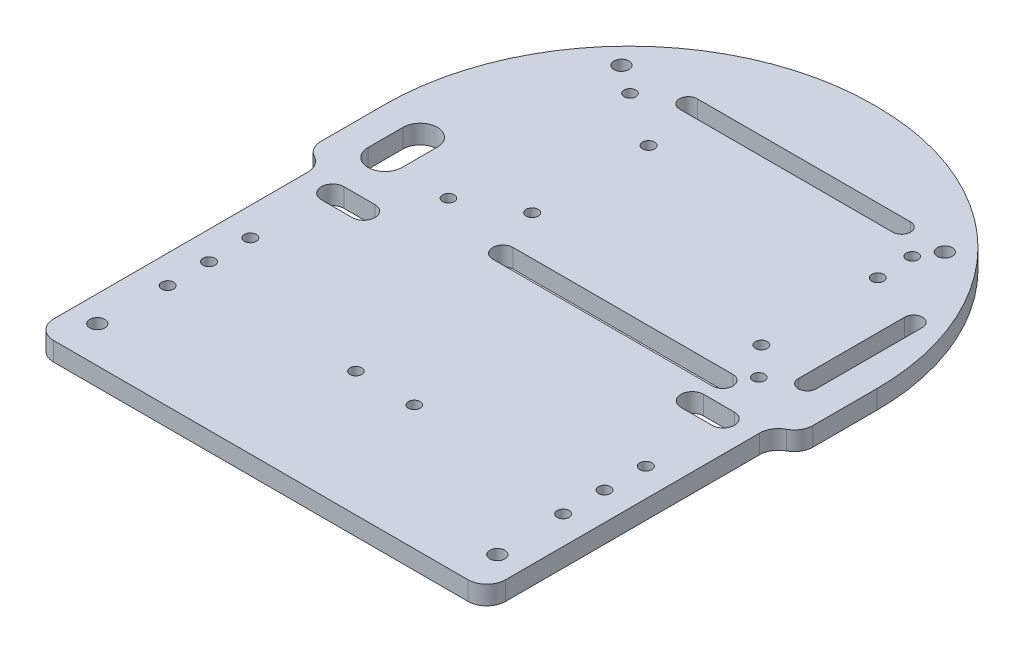
from build123d import *

# Parameters (mm, degrees)
BOSS_EXTRUDE2_DEPTH = 5
FILLET8_R           = 65
SKETCH4_R           = 2
SKETCH4_R_2         = 1.5621
SKETCH4_R_3         = 1.55575
SKETCH4_R_4         = 1.6
CUT_EXTRUDE1_DEPTH  = 5
FILLET9_R           = 5
FILLET10_R          = 5


with BuildPart() as part:
    # Sketch1 → Boss-Extrude2 (new body)
    with BuildSketch(Plane(origin=(0, 0, 0), x_dir=(1, 0, 0), z_dir=(0, 1, 0))):
        Polygon((65.5, 80), (-65.5, 80), (-65.5, -7), (-60.15, -7), (-60.15, -83.5), (60.15, -83.5), (60.15, -7), (65.5, -7), align=None)
    extrude(amount=BOSS_EXTRUDE2_DEPTH)

    # Fillet8
    fillet8_edges = [part.edges().sort_by_distance(p)[0] for p in [
        (-65.5, 2.5, -80),
        (65.5, 2.5, -80),
    ]]
    fillet(fillet8_edges, radius=FILLET8_R)

    # Sketch4 → Cut-Extrude1 (cut)
    with BuildSketch(Plane(origin=(0, 5, 0), x_dir=(1, 0, 0), z_dir=(0, 1, 0))):
        with Locations(Location((43.047144734, 55.54428083, 0), (0, 0, 270))):
            Circle(SKETCH4_R)
        with Locations(Location((-43.047144734, 55.54428083, 0), (0, 0, 90))):
            Circle(SKETCH4_R)
        with Locations(Location((-53.249046458, -73.796312774, 0), (0, 0, 270))):
            Circle(SKETCH4_R)
        with Locations(Location((53.249046458, -73.796312774, 0), (0, 0, 90))):
            Circle(SKETCH4_R)
        with Locations(Location((-35.41902795, 50.193626152, 0), (0, 0, 270))):
            Circle(SKETCH4_R_2)
        with Locations(Location((39.71417205, 50.193626152, 0), (0, 0, 270))):
            Circle(SKETCH4_R_2)
        with Locations(Location((-35.41902795, 1.857426152, 0), (0, 0, 270))):
            Circle(SKETCH4_R_2)
        with Locations(Location((47.20717205, 1.857426152, 0), (0, 0, 270))):
            Circle(SKETCH4_R_2)
        with Locations(Location((-7.869013511, -50.333617588, 0), (0, 0, 270))):
            Circle(SKETCH4_R_3)
        with Locations(Location((7.688486489, -50.333617588, 0), (0, 0, 270))):
            Circle(SKETCH4_R_3)
        with Locations(Location((40.071563944, 40.662108402, 0), (0, 0, 270))):
            Circle(SKETCH4_R_4)
        with Locations(Location((40.071563944, 9.662108402, 0), (0, 0, 270))):
            Circle(SKETCH4_R_4)
        with Locations(Location((-20.928436056, 40.662108402, 0), (0, 0, 270))):
            Circle(SKETCH4_R_4)
        with Locations(Location((-20.928436056, 9.662108402, 0), (0, 0, 270))):
            Circle(SKETCH4_R_4)
        with Locations(Location((52.65, -33.659925039, 0), (0, 0, 270))):
            Circle(SKETCH4_R_4)
        with Locations(Location((52.65, -44.659925039, 0), (0, 0, 270))):
            Circle(SKETCH4_R_4)
        with Locations(Location((52.65, -55.659925039, 0), (0, 0, 270))):
            Circle(SKETCH4_R_4)
        with Locations(Location((-52.65, -55.659925039, 0), (0, 0, 90))):
            Circle(SKETCH4_R_4)
        with Locations(Location((-52.65, -44.659925039, 0), (0, 0, 90))):
            Circle(SKETCH4_R_4)
        with Locations(Location((-52.65, -33.659925039, 0), (0, 0, 90))):
            Circle(SKETCH4_R_4)
        with BuildLine():
            Line((-25.229195822, 57.914440008), (31.548032439, 57.914440008))
            ThreePointArc((31.548032439, 57.914440008), (33.918191616, 55.54428083), (31.548032439, 53.174121653))
            Line((31.548032439, 53.174121653), (-25.229195822, 53.174121653))
            ThreePointArc((-25.229195822, 53.174121653), (-27.599355, 55.54428083), (-25.229195822, 57.914440008))
        make_face()
        with BuildLine():
            Line((-15.471860298, -0.8868659), (43.047144734, -0.8868659))
            ThreePointArc((43.047144734, -0.8868659), (45.750426625, -3.590147791), (43.047144734, -6.293429682))
            Line((43.047144734, -6.293429682), (-15.471860298, -6.293429682))
            ThreePointArc((-15.471860298, -6.293429682), (-18.175142189, -3.590147791), (-15.471860298, -0.8868659))
        make_face()
        with BuildLine():
            Line((57.484245228, 35.149431205), (57.484245228, 6.868248507))
            ThreePointArc((57.484245228, 6.868248507), (55.106623673, 4.490626953), (52.729002119, 6.868248507))
            Line((52.729002119, 6.868248507), (52.729002119, 35.149431205))
            ThreePointArc((52.729002119, 35.149431205), (55.106623673, 37.52705276), (57.484245228, 35.149431205))
        make_face()
        with BuildLine():
            Line((-51.995557855, -9.38715687), (-43.754184302, -9.38715687))
            ThreePointArc((-43.754184302, -9.38715687), (-40.74405673, -12.397284441), (-43.754184302, -15.407412013))
            Line((-43.754184302, -15.407412013), (-51.995557855, -15.407412013))
            ThreePointArc((-51.995557855, -15.407412013), (-55.005685427, -12.397284441), (-51.995557855, -9.38715687))
        make_face()
        with BuildLine():
            Line((51.995557855, -9.38715687), (43.754184302, -9.38715687))
            ThreePointArc((43.754184302, -9.38715687), (40.74405673, -12.397284441), (43.754184302, -15.407412013))
            Line((43.754184302, -15.407412013), (51.995557855, -15.407412013))
            ThreePointArc((51.995557855, -15.407412013), (55.005685427, -12.397284441), (51.995557855, -9.38715687))
        make_face()
        with BuildLine():
            Line((-48.684552143, 12.171246466), (-48.684552143, 2.805296047))
            ThreePointArc((-48.684552143, 2.805296047), (-53.249046458, -1.759198268), (-57.813540773, 2.805296047))
            Line((-57.813540773, 2.805296047), (-57.813540773, 12.171246466))
            ThreePointArc((-57.813540773, 12.171246466), (-53.249046458, 16.73574078), (-48.684552143, 12.171246466))
        make_face()
    extrude(amount=-CUT_EXTRUDE1_DEPTH, mode=Mode.SUBTRACT)

    # Fillet9
    fillet9_edges = [part.edges().sort_by_distance(p)[0] for p in [
        (60.15, 2.5, 83.5),
        (-60.15, 2.5, 83.5),
        (-65.5, 2.5, 7),
        (65.5, 2.5, 7),
    ]]
    fillet(fillet9_edges, radius=FILLET9_R)

    # Fillet10
    fillet10_edges = [part.edges().sort_by_distance(p)[0] for p in [
        (60.15, 2.5, 7),
        (-60.15, 2.5, 7),
    ]]
    fillet(fillet10_edges, radius=FILLET10_R)


solid = part.part
